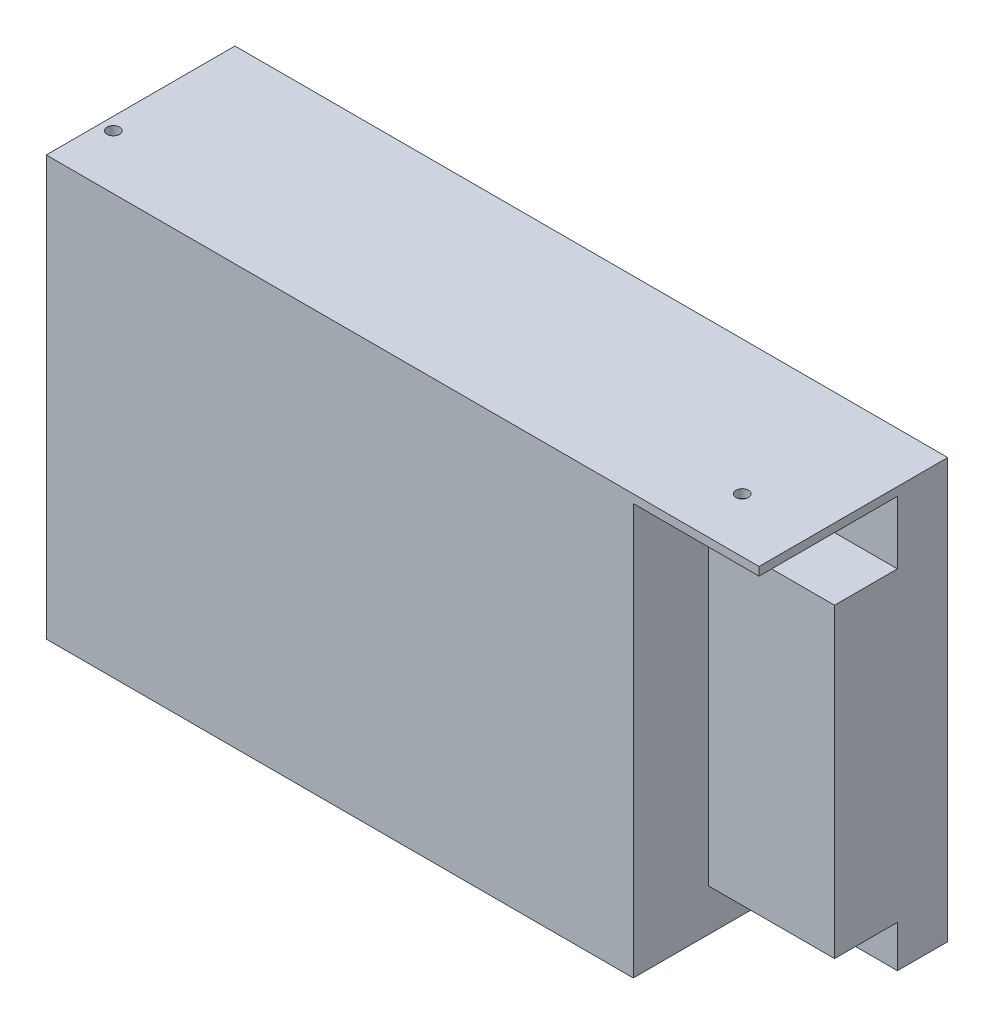
from build123d import *

# Parameters (mm, degrees)
SKETCH1_W           = 170
SKETCH1_H           = 100
BOSS_EXTRUDE1_DEPTH = 45
SKETCH3_W           = 30
SKETCH3_H           = 98
CUT_EXTRUDE2_DEPTH  = 18
SKETCH4_W           = 30
SKETCH4_H           = 10
SKETCH4_H_2         = 15
CUT_EXTRUDE3_DEPTH  = 15
SKETCH5_R           = 1.5
CUT_EXTRUDE4_DEPTH  = 3


with BuildPart() as part:
    # Sketch1 → Boss-Extrude1 (new body)
    with BuildSketch(Plane.XY):
        with Locations((76.199255121, -45.298882682)):
            Rectangle(SKETCH1_W, SKETCH1_H)
    extrude(amount=BOSS_EXTRUDE1_DEPTH)

    # Sketch3 → Cut-Extrude2 (cut)
    with BuildSketch(Plane.XY.offset(45)):
        with Locations((146.199255121, -46.298882682)):
            Rectangle(SKETCH3_W, SKETCH3_H)
    extrude(amount=-CUT_EXTRUDE2_DEPTH, mode=Mode.SUBTRACT)

    # Sketch4 → Cut-Extrude3 (cut)
    with BuildSketch(Plane.XY.offset(27)):
        with Locations((146.199255121, -90.298882682)):
            Rectangle(SKETCH4_W, SKETCH4_H)
        with Locations((146.199255121, -4.798882682)):
            Rectangle(SKETCH4_W, SKETCH4_H_2)
    extrude(amount=-CUT_EXTRUDE3_DEPTH, mode=Mode.SUBTRACT)

    # Sketch5 → Cut-Extrude4 (cut)
    with BuildSketch(Plane(origin=(0, 4.701117318, 0), x_dir=(1, 0, 0), z_dir=(0, 1, 0))):
        with Locations(Location((-5.800744879, -32, 0), (0, 0, 270))):
            Circle(SKETCH5_R)
        with Locations(Location((144.199255121, -32, 0), (0, 0, 270))):
            Circle(SKETCH5_R)
    extrude(amount=-CUT_EXTRUDE4_DEPTH, mode=Mode.SUBTRACT)


solid = part.part
